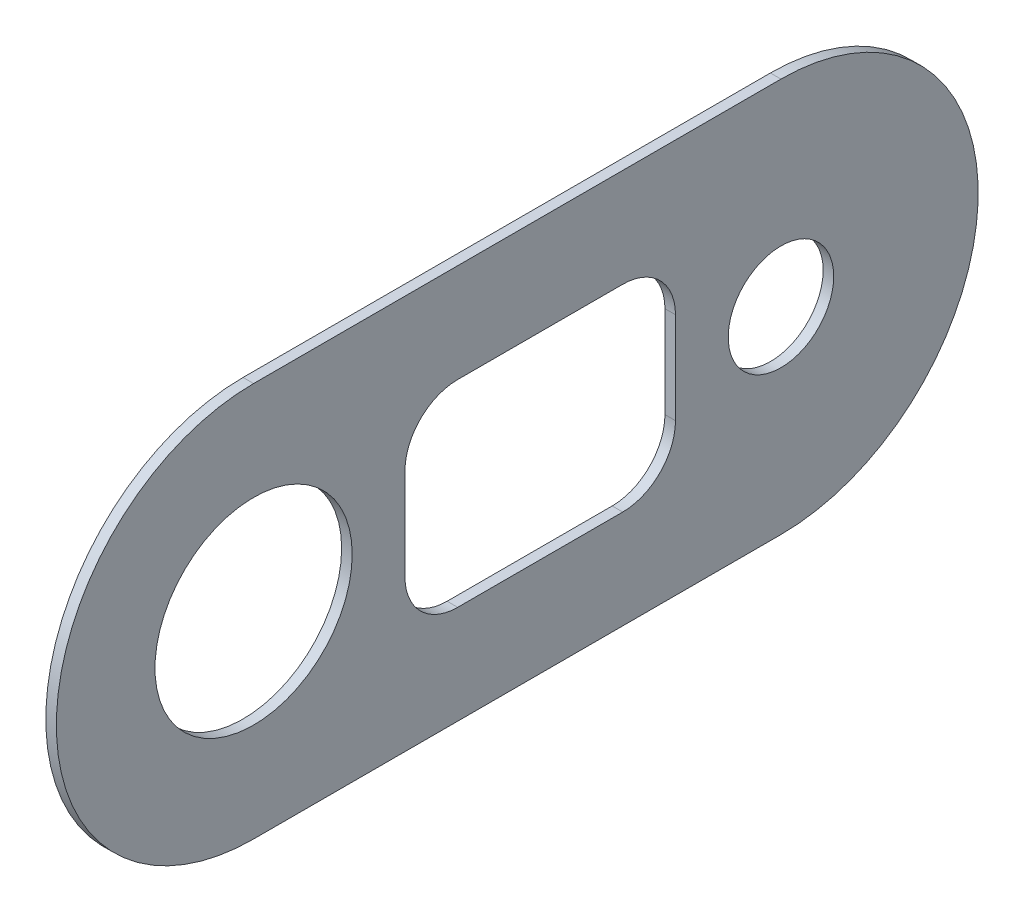
from build123d import *

# Parameters (mm, degrees)
SKETCH1_R           = 12.7
SKETCH1_R_2         = 23.749
BOSS_EXTRUDE2_DEPTH = 2.54


with BuildPart() as part:
    # Sketch1 → Boss-Extrude2 (new body)
    with BuildSketch(Plane.YZ):
        with BuildLine():
            Line((0, 0), (0, 127))
            ThreePointArc((0, 127), (47.498, 174.498), (94.996, 127))
            Line((94.996, 127), (94.996, 0))
            ThreePointArc((94.996, 0), (47.498, -47.498), (0, 0))
        make_face()
        with Locations(Location((47.498, 0, 0), (0, 0, 270))):
            Circle(SKETCH1_R, mode=Mode.SUBTRACT)
        with Locations(Location((47.498, 127, 0), (0, 0, 270))):
            Circle(SKETCH1_R_2, mode=Mode.SUBTRACT)
        with BuildLine():
            Line((36.449, 90.551), (58.547, 90.551))
            ThreePointArc((58.547, 90.551), (67.527256121, 86.831256121), (71.247, 77.851))
            Line((71.247, 77.851), (71.247, 38.1))
            ThreePointArc((71.247, 38.1), (67.527256121, 29.119743879), (58.547, 25.4))
            Line((58.547, 25.4), (36.449, 25.4))
            ThreePointArc((36.449, 25.4), (27.468743879, 29.119743879), (23.749, 38.1))
            Line((23.749, 38.1), (23.749, 77.851))
            ThreePointArc((23.749, 77.851), (27.468743879, 86.831256121), (36.449, 90.551))
        make_face(mode=Mode.SUBTRACT)
    extrude(amount=BOSS_EXTRUDE2_DEPTH)


solid = part.part
